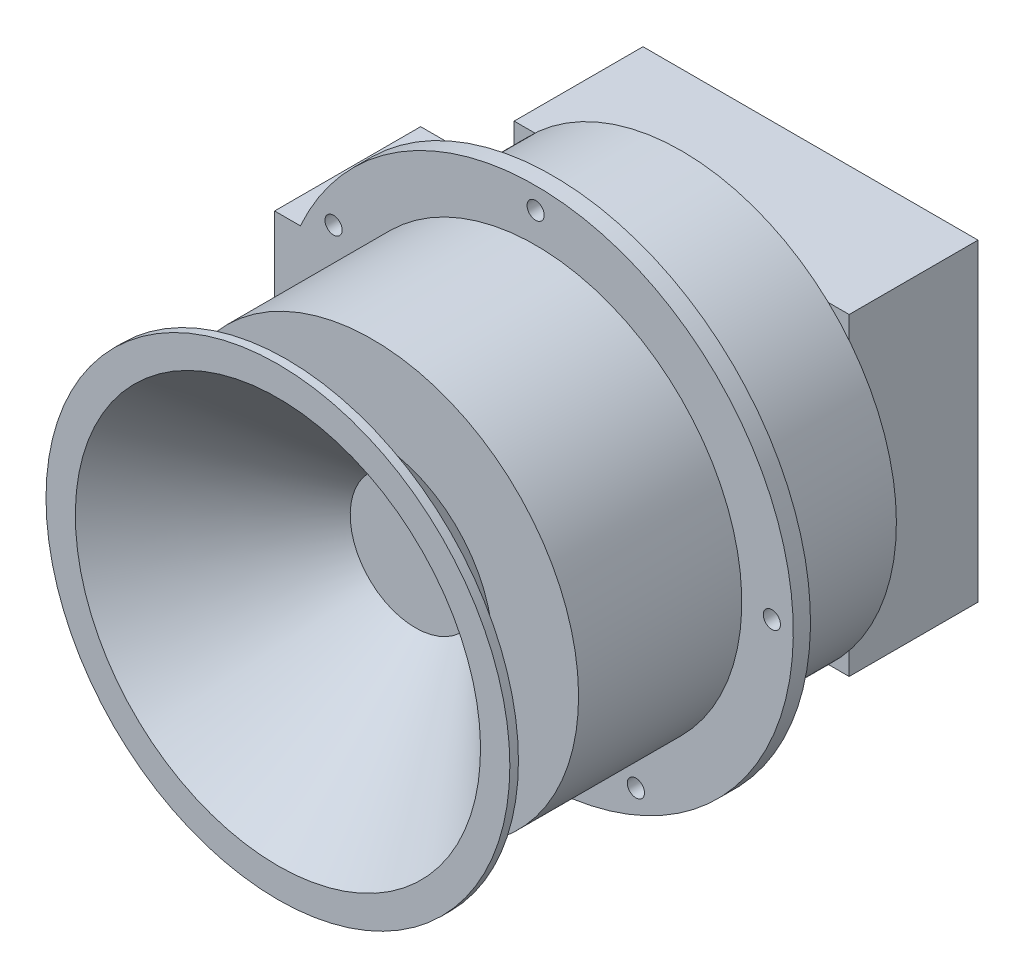
from build123d import *

# Parameters (mm, degrees)
SKETCH1_R           = 1
BOSS_EXTRUDE1_DEPTH = 2
BOSS_EXTRUDE2_DEPTH = 15
SKETCH3_W           = 39
SKETCH3_H           = 36.5
BOSS_EXTRUDE3_DEPTH = 15
SKETCH4_R           = 24
BOSS_EXTRUDE4_DEPTH = 13
SKETCH6_R           = 5
BOSS_EXTRUDE5_DEPTH = 6.5


with BuildPart() as part:
    # Sketch1 → Boss-Extrude1 (new body)
    with BuildSketch(Plane.XY):
        with BuildLine():
            Line((-27.387019607, 12.245454545), (-30.387019607, 12.245454545))
            Line((-30.387019607, 12.245454545), (-30.387019607, -4.754545455))
            Line((-30.387019607, -4.754545455), (-25.291436328, -18.754545455))
            Line((-25.291436328, -18.754545455), (-23.415102494, -18.754545455))
            ThreePointArc((-23.415102494, -18.754545455), (29.756745496, 3.812623441), (-27.387019607, 12.245454545))
        make_face()
        with Locations((0, 27.5)):
            Circle(SKETCH1_R, mode=Mode.SUBTRACT)
        with Locations((-23.5226917, 14.245454545)):
            Circle(SKETCH1_R, mode=Mode.SUBTRACT)
        with Locations((27.5, 0)):
            Circle(SKETCH1_R, mode=Mode.SUBTRACT)
        with Locations((11.677272727, -24.897616385)):
            Circle(SKETCH1_R, mode=Mode.SUBTRACT)
    extrude(amount=BOSS_EXTRUDE1_DEPTH)

    # Sketch2 → Boss-Extrude2 (add)
    with BuildSketch(Plane(origin=(0, 0, 0), x_dir=(-1, 0, 0), z_dir=(0, 0, -1))):
        with BuildLine():
            Line((25.291436328, -18.754545455), (23.415102494, -18.754545455))
            Line((23.415102494, -18.754545455), (16.530790205, -18.754545455))
            ThreePointArc((16.530790205, -18.754545455), (-24.647075653, 4.185888405), (21.795615224, 12.245454545))
            Line((21.795615224, 12.245454545), (27.387019607, 12.245454545))
            Line((27.387019607, 12.245454545), (30.387019607, 12.245454545))
            Line((30.387019607, 12.245454545), (30.387019607, -4.754545455))
            Line((30.387019607, -4.754545455), (25.291436328, -18.754545455))
        make_face()
    extrude(amount=BOSS_EXTRUDE2_DEPTH)

    # Sketch4 → Boss-Extrude4 (add)
    with BuildSketch(Plane.XY.offset(2)):
        with Locations(Location((0, 0, 0), (0, 0, 180))):
            Circle(SKETCH4_R)
    extrude(amount=BOSS_EXTRUDE4_DEPTH)

    # Sketch5 → Revolve1 (revolve)
    with BuildSketch(Plane(origin=(0, 0, 0), x_dir=(0, 0, -1), z_dir=(1, 0, 0)), mode=Mode.PRIVATE) as revolve1_sk:
        Polygon((-15, 0), (-15, 24), (-21, 24), (-21, 14), (-31, 24), (-31, 27), (-32, 27), (-32, 23.585786438), (-16, 7.585786438), (-16, 0), align=None)
    revolve(revolve1_sk.sketch.rotate(Axis((0, 0, 16), (0, 0, -1)), 180), axis=Axis((0, 0, 16), (0, 0, -1)))

    # Sketch6 → Boss-Extrude5 (add)
    with BuildSketch(Plane.XY.offset(2)):
        with Locations((-24, 0)):
            Circle(SKETCH6_R)
    extrude(amount=BOSS_EXTRUDE5_DEPTH)


with BuildPart() as body_2:
    # Sketch3 → Boss-Extrude3 (new body)
    with BuildSketch(Plane(origin=(0, 0, -15), x_dir=(-1, 0, 0), z_dir=(0, 0, -1))):
        Rectangle(SKETCH3_W, SKETCH3_H)
    extrude(amount=BOSS_EXTRUDE3_DEPTH)


solid = Compound([part.part, body_2.part])
